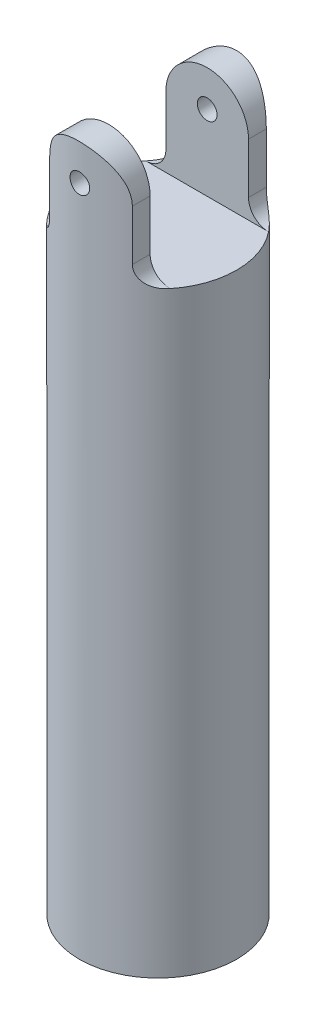
from build123d import *

# Parameters (mm, degrees)
SKETCH1_R               = 6
BOSS_EXTRUDE1_DEPTH     = 12
CUT_EXTRUDE1_DEPTH      = 15.696938457
CUT_EXTRUDE1_DEPTH_BACK = 15.696938457
SKETCH2_W               = 7.5
SKETCH2_H               = 8.5
CUT_EXTRUDE2_DEPTH      = 15.696938457
CUT_EXTRUDE2_DEPTH_BACK = 15.696938457
SKETCH3_R               = 0.75
BOSS_EXTRUDE2_START     = 42
SKETCH4_R               = 6
BOSS_EXTRUDE2_DEPTH     = 42


with BuildPart() as part:
    # Sketch1 → Boss-Extrude1 (new body)
    with BuildSketch(Plane(origin=(0, 0, 0), x_dir=(1, 0, 0), z_dir=(0, 1, 0))):
        with Locations(Location((0, 0, 0), (0, 0, 270))):
            Circle(SKETCH1_R)
    extrude(amount=BOSS_EXTRUDE1_DEPTH)

    # Sketch2 → Cut-Extrude1 (cut, two sides: drawn at the far end of the back side and taken through both)
    with BuildSketch(Plane(origin=(0, 0, 0), x_dir=(0, 0, -1), z_dir=(1, 0, 0)).offset(-CUT_EXTRUDE1_DEPTH_BACK)):
        with Locations((0, 7.75)):
            Rectangle(SKETCH2_W, SKETCH2_H)
    extrude(amount=CUT_EXTRUDE1_DEPTH + CUT_EXTRUDE1_DEPTH_BACK, mode=Mode.SUBTRACT)

    # Sketch3 → Cut-Extrude2 (cut, two sides: drawn at the far end of the back side and taken through both)
    with BuildSketch(Plane.XY.offset(-CUT_EXTRUDE2_DEPTH_BACK)):
        with BuildLine():
            Line((-3.15, 5), (-3.15, 8.85))
            ThreePointArc((-3.15, 8.85), (-2.227386361, 11.077386361), (0, 12))
            Line((0, 12), (-4.683748499, 12))
            Line((-4.683748499, 12), (-4.683748499, 3.5))
            Line((-4.683748499, 3.5), (-4.65, 3.5))
            ThreePointArc((-4.65, 3.5), (-3.589339828, 3.939339828), (-3.15, 5))
        make_face()
        with BuildLine():
            Line((4.683748499, 12), (0, 12))
            ThreePointArc((0, 12), (2.227386361, 11.077386361), (3.15, 8.85))
            Line((3.15, 8.85), (3.15, 5))
            ThreePointArc((3.15, 5), (3.589339828, 3.939339828), (4.65, 3.5))
            Line((4.65, 3.5), (4.683748499, 3.5))
            Line((4.683748499, 3.5), (4.683748499, 12))
        make_face()
        with Locations((0, 9.25)):
            Circle(SKETCH3_R)
    extrude(amount=CUT_EXTRUDE2_DEPTH + CUT_EXTRUDE2_DEPTH_BACK, mode=Mode.SUBTRACT)

    # Sketch4 → Boss-Extrude2 (add)
    with BuildSketch(Plane.XZ.offset(BOSS_EXTRUDE2_START)):
        with Locations(Location((0, 0, 0), (0, 0, 270))):
            Circle(SKETCH4_R)
        with BuildLine():
            Line((-0.6, 4.207433897), (-0.6, 5))
            Line((-0.6, 5), (0.6, 5))
            Line((0.6, 5), (0.6, 4.207433897))
            ThreePointArc((0.6, 4.207433897), (2.799894973, 3.19735643), (4.091454509, 1.15))
            Line((4.091454509, 1.15), (5, 1.15))
            Line((5, 1.15), (5, -1.15))
            Line((5, -1.15), (4.091454509, -1.15))
            ThreePointArc((4.091454509, -1.15), (2.799894973, -3.19735643), (0.6, -4.207433897))
            Line((0.6, -4.207433897), (0.6, -5))
            Line((0.6, -5), (-0.6, -5))
            Line((-0.6, -5), (-0.6, -4.207433897))
            ThreePointArc((-0.6, -4.207433897), (-2.799894973, -3.19735643), (-4.091454509, -1.15))
            Line((-4.091454509, -1.15), (-5, -1.15))
            Line((-5, -1.15), (-5, 1.15))
            Line((-5, 1.15), (-4.091454509, 1.15))
            ThreePointArc((-4.091454509, 1.15), (-2.799894973, 3.19735643), (-0.6, 4.207433897))
        make_face(mode=Mode.SUBTRACT)
    extrude(amount=-BOSS_EXTRUDE2_DEPTH)


solid = part.part
